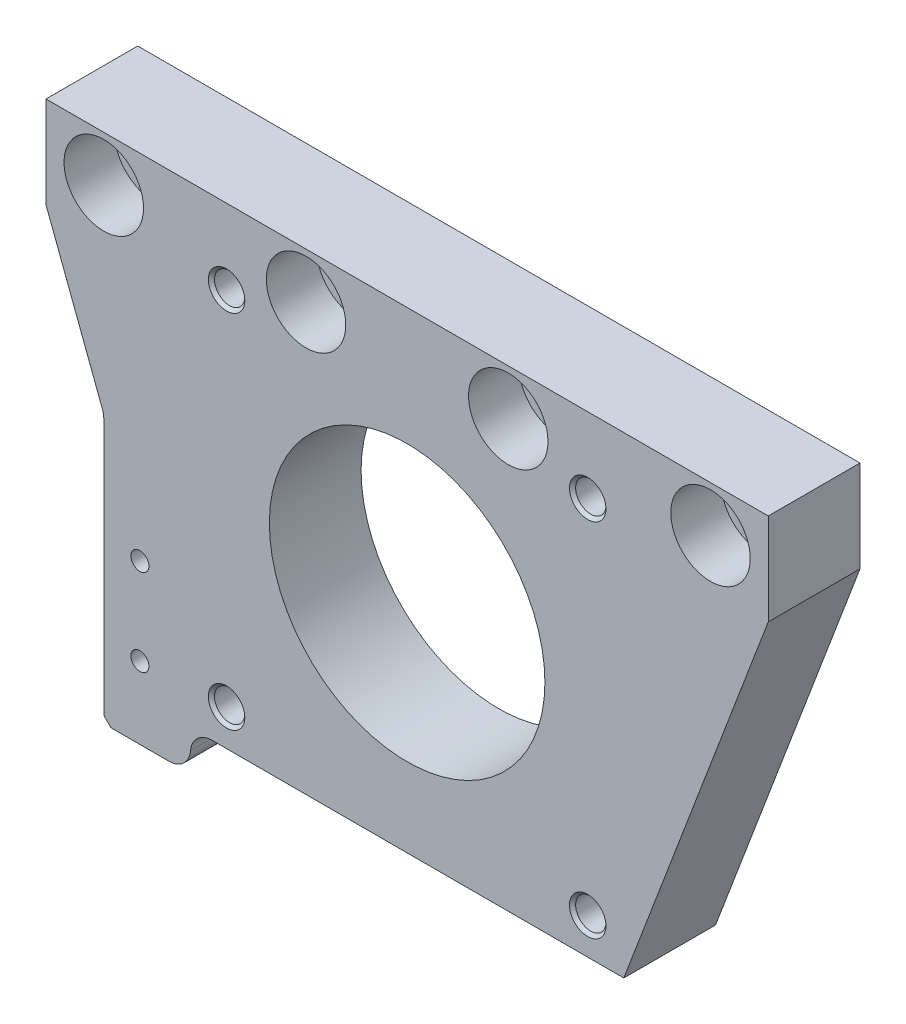
from build123d import *

# Parameters (mm, degrees)
SKETCH3_R                       = 19.075
SKETCH3_R_2                     = 2.525
BOSS_EXTRUDE1_DEPTH             = 12.7
M5X0_8_TAPPED_HOLE1_D           = 4.2
M5X0_8_TAPPED_HOLE1_CSINK_D     = 5.05
M5X0_8_TAPPED_HOLE1_CSINK_ANGLE = 90
SKETCH8_R                       = 5.5
CUT_EXTRUDE1_DEPTH              = 7
BOSS_EXTRUDE2_DEPTH             = 12.7
FILLET1_R                       = 3
FILLET2_R                       = 3
CHAMFER1_SIZE                   = 1
M3X0_5_TAPPED_HOLE2_D           = 2.5


with BuildPart() as part:
    # Sketch3 → Boss-Extrude1 (new body)
    with BuildSketch(Plane.XY):
        Polygon((-50, 35.4), (50, 35.4), (50, 22.7), (30, -30), (-30, -30), (-50, 22.7), align=None)
        Circle(SKETCH3_R, mode=Mode.SUBTRACT)
        with Locations((-42, 29.05)):
            Circle(SKETCH3_R_2, mode=Mode.SUBTRACT)
        with Locations(Location((42, 29.05, 0), (0, 0, 180))):
            Circle(SKETCH3_R_2, mode=Mode.SUBTRACT)
        with Locations((-14, 29.05)):
            Circle(SKETCH3_R_2, mode=Mode.SUBTRACT)
        with Locations(Location((14, 29.05, 0), (0, 0, 180))):
            Circle(SKETCH3_R_2, mode=Mode.SUBTRACT)
    extrude(amount=-BOSS_EXTRUDE1_DEPTH)

    # M5x0.8 Tapped Hole1 (through all)
    with Locations(Plane.XY):
        with Locations((-25, 25), (25, 25), (25, -25), (-25, -25)):
            CounterSinkHole(M5X0_8_TAPPED_HOLE1_D / 2, M5X0_8_TAPPED_HOLE1_CSINK_D / 2, counter_sink_angle=M5X0_8_TAPPED_HOLE1_CSINK_ANGLE)

    # Sketch8 → Cut-Extrude1 (cut)
    with BuildSketch(Plane.XY):
        with Locations((-42, 29.05)):
            Circle(SKETCH8_R)
        with Locations((-14, 29.05)):
            Circle(SKETCH8_R)
        with Locations((14, 29.05)):
            Circle(SKETCH8_R)
        with Locations((42, 29.05)):
            Circle(SKETCH8_R)
    extrude(amount=-CUT_EXTRUDE1_DEPTH, mode=Mode.SUBTRACT)

    # Sketch9 → Boss-Extrude2 (add)
    with BuildSketch(Plane.XY):
        Polygon((-30, -30), (-30, -35.5), (-42, -35.5), (-42, 1.62), align=None)
    extrude(amount=-BOSS_EXTRUDE2_DEPTH)

    # Fillet1
    fillet1_edges = [part.edges().sort_by_distance(p)[0] for p in [
        (-30, -30, -6.35),
        (-42, 1.62, -6.35),
    ]]
    fillet(fillet1_edges, radius=FILLET1_R)

    # Fillet2
    fillet2_edges = [part.edges().sort_by_distance(p)[0] for p in [
        (-30, -35.5, -6.35),
    ]]
    fillet(fillet2_edges, radius=FILLET2_R)

    # Chamfer1
    chamfer1_edges = [part.edges().sort_by_distance(p)[0] for p in [
        (-42, -35.5, -6.35),
    ]]
    chamfer(chamfer1_edges, length=CHAMFER1_SIZE)

    # M3x0.5 Tapped Hole2 (through all)
    with Locations(Plane.XY):
        with Locations((-37, -13.5), (-37, -25.5)):
            Hole(M3X0_5_TAPPED_HOLE2_D / 2)


solid = part.part
